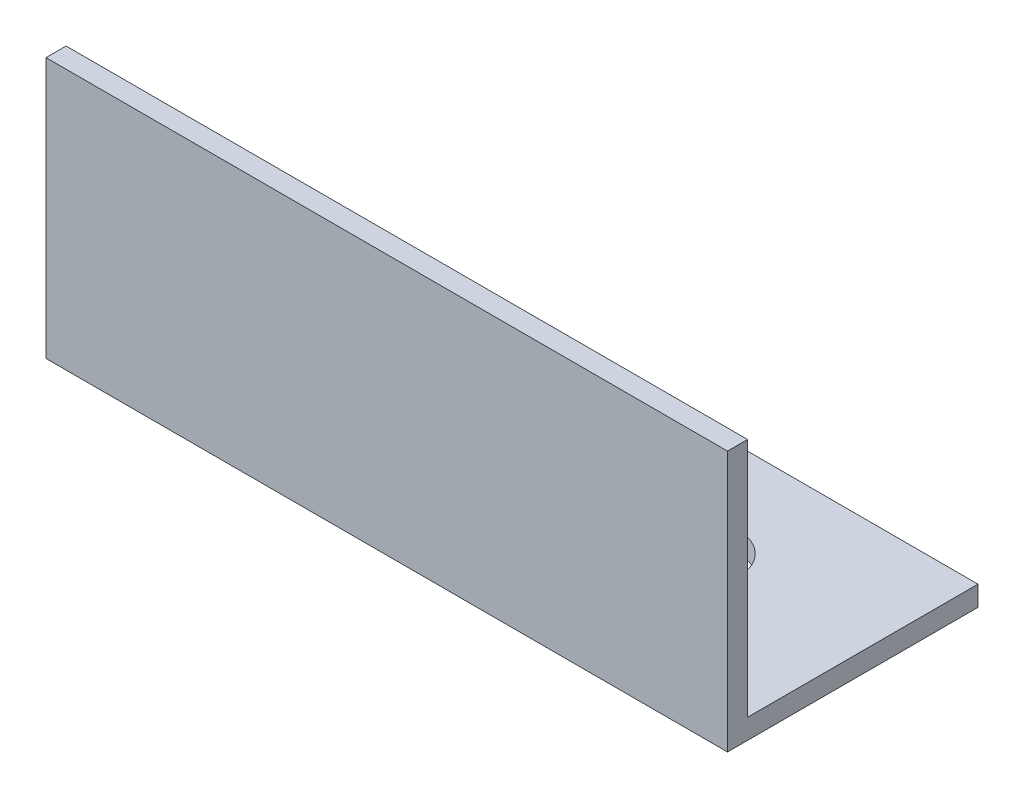
from build123d import *

# Parameters (mm, degrees)
SKETCH1_W               = 53.98
SKETCH1_H               = 1.59
BOSS_EXTRUDE1_DEPTH     = 20.64
SKETCH1_3_W             = 53.98
SKETCH1_3_H             = 18.26
SKETCH1_3_R             = 3.175
SKETCH1_3_H_2           = 18.25
BOSS_EXTRUDE2_DEPTH     = 1.59
CUT_EXTRUDE1_DEPTH      = 39.134827914
CUT_EXTRUDE1_DEPTH_BACK = 39.134827914
SKETCH3_W               = 53.98
SKETCH3_H               = 18.26


with BuildPart() as part:
    # Sketch1 → Boss-Extrude1 (new body)
    with BuildSketch(Plane(origin=(0, 0, 0), x_dir=(1, 0, 0), z_dir=(0, 1, 0))):
        with Locations((0, 0.005)):
            Rectangle(SKETCH1_W, SKETCH1_H)
    extrude(amount=BOSS_EXTRUDE1_DEPTH)

    # Sketch1<3> → Boss-Extrude2 (add)
    # profile 1 of 2: a face of its own
    with BuildSketch(Plane(origin=(0, 0, 0), x_dir=(1, 0, 0), z_dir=(0, 1, 0))):
        with Locations((0, -9.92)):
            Rectangle(SKETCH1_3_W, SKETCH1_3_H)
        with Locations((-13.825, -10.08)):
            Circle(SKETCH1_3_R, mode=Mode.SUBTRACT)
        with Locations((13.825, -10.08)):
            Circle(SKETCH1_3_R, mode=Mode.SUBTRACT)
    # profile 2 of 2: a face of its own
    with BuildSketch(Plane(origin=(0, 0, 0), x_dir=(1, 0, 0), z_dir=(0, 1, 0))):
        with Locations((0, 9.925)):
            Rectangle(SKETCH1_3_W, SKETCH1_3_H_2)
        with Locations((-13.825, 10.08)):
            Circle(SKETCH1_3_R, mode=Mode.SUBTRACT)
        with Locations((13.825, 10.08)):
            Circle(SKETCH1_3_R, mode=Mode.SUBTRACT)
    extrude(amount=BOSS_EXTRUDE2_DEPTH)

    # Sketch3 → Cut-Extrude1 (cut, two sides: drawn at the far end of the back side and taken through both)
    with BuildSketch(Plane(origin=(0, 1.59, 0), x_dir=(1, 0, 0), z_dir=(0, 1, 0)).offset(-CUT_EXTRUDE1_DEPTH_BACK)):
        with Locations((0, -9.92)):
            Rectangle(SKETCH3_W, SKETCH3_H)
    extrude(amount=CUT_EXTRUDE1_DEPTH + CUT_EXTRUDE1_DEPTH_BACK, mode=Mode.SUBTRACT)


solid = part.part
